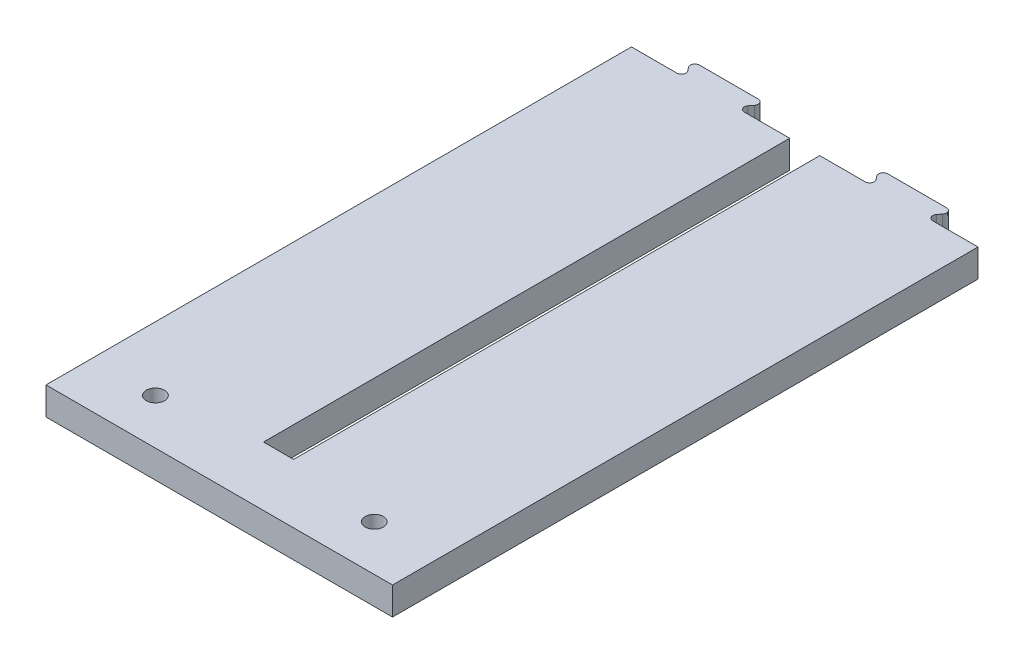
from build123d import *

# Parameters (mm, degrees)
SKETCH1_W           = 38
SKETCH1_H           = 72.5
BOSS_EXTRUDE1_DEPTH = 3.05
SKETCH4_W           = 1.65
SKETCH4_H           = 1
SKETCH4_H_2         = 61.8
CUT_EXTRUDE1_DEPTH  = 76.010349286
SKETCH7_R           = 1
CUT_EXTRUDE4_DEPTH  = 76.010349286
SKETCH8_W           = 38
SKETCH8_H           = 8.3
CUT_EXTRUDE5_DEPTH  = 76.010349286
BOSS_EXTRUDE3_DEPTH = 3.05
FILLET2_R           = 0.5


with BuildPart() as part:
    # Sketch1 → Boss-Extrude1 (new body)
    with BuildSketch(Plane(origin=(0, 0, 0), x_dir=(1, 0, 0), z_dir=(0, 1, 0))):
        with Locations((0, 36.25)):
            Rectangle(SKETCH1_W, SKETCH1_H)
    extrude(amount=BOSS_EXTRUDE1_DEPTH)

    # Sketch4 → Cut-Extrude1 (cut, through all)
    with BuildSketch(Plane(origin=(0, 3.05, 0), x_dir=(1, 0, 0), z_dir=(0, 1, 0))):
        with Locations((-0.825, 70)):
            Rectangle(SKETCH4_W, SKETCH4_H)
        with Locations((-0.825, 37.4)):
            Rectangle(SKETCH4_W, SKETCH4_H_2)
        with Locations((0.825, 37.4)):
            Rectangle(SKETCH4_W, SKETCH4_H_2)
        with Locations((0.825, 70)):
            Rectangle(SKETCH4_W, SKETCH4_H)
    extrude(amount=-CUT_EXTRUDE1_DEPTH, mode=Mode.SUBTRACT)

    # Sketch7 → Cut-Extrude4 (cut, through all)
    with BuildSketch(Plane(origin=(0, 3.05, 0), x_dir=(1, 0, 0), z_dir=(0, 1, 0))):
        with Locations(Location((-12, 5, 0), (0, 0, 270))):
            Circle(SKETCH7_R)
        with Locations(Location((12, 5, 0), (0, 0, 90))):
            Circle(SKETCH7_R)
    extrude(amount=-CUT_EXTRUDE4_DEPTH, mode=Mode.SUBTRACT)

    # Sketch8 → Cut-Extrude5 (cut, through all)
    with BuildSketch(Plane(origin=(0, 3.05, 0), x_dir=(1, 0, 0), z_dir=(0, 1, 0))):
        with Locations((0, 68.35)):
            Rectangle(SKETCH8_W, SKETCH8_H)
    extrude(amount=-CUT_EXTRUDE5_DEPTH, mode=Mode.SUBTRACT)

    # Sketch9 → Boss-Extrude3 (add)
    with BuildSketch(Plane(origin=(0, 3.05, 0), x_dir=(1, 0, 0), z_dir=(0, 1, 0))):
        Polygon((-14.575, 66.2), (-13, 64.2), (-7.65, 64.2), (-6.075, 66.2), align=None)
        Polygon((6.075, 66.2), (7.65, 64.2), (13, 64.2), (14.575, 66.2), align=None)
    extrude(amount=-BOSS_EXTRUDE3_DEPTH)

    # Fillet2
    fillet2_edges = [part.edges().sort_by_distance(p)[0] for p in [
        (-6.075, 1.525, -66.2),
        (-7.65, 1.525, -64.2),
        (-13, 1.525, -64.2),
        (-14.575, 1.525, -66.2),
        (14.575, 1.525, -66.2),
        (13, 1.525, -64.2),
        (7.65, 1.525, -64.2),
        (6.075, 1.525, -66.2),
    ]]
    fillet(fillet2_edges, radius=FILLET2_R)


solid = part.part
